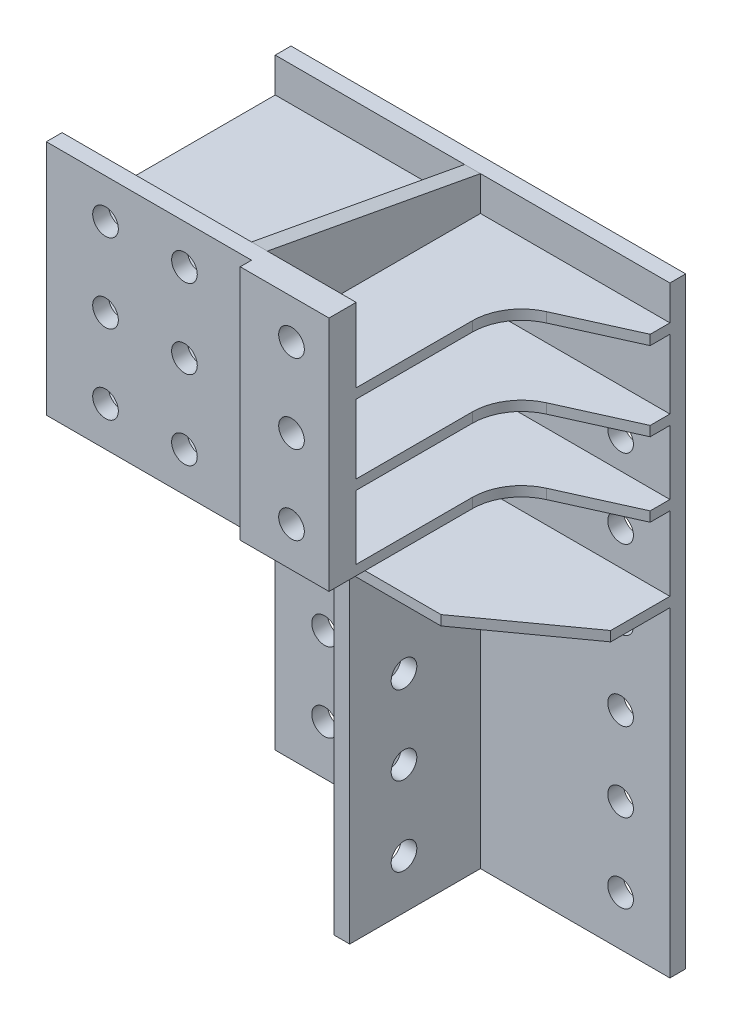
from build123d import *

# Parameters (mm, degrees)
SKETCH_1_W                       = 400
SKETCH_1_H                       = 610
EXTRUDE_1_DEPTH                  = 16
SKETCH_2_R                       = 13
CUT_EXTRUDE_1_DEPTH              = 730.627302121
PATTERN_LINEAR_1_COUNT           = 2
PATTERN_LINEAR_1_PITCH           = 300
PATTERN_LINEAR_1_COUNT_DIR2      = 6
PATTERN_LINEAR_1_PITCH_DIR2      = 80
SKETCH_3_W                       = 16
SKETCH_3_H                       = 650
EXTRUDE_2_DEPTH                  = 216
SKETCH_4_R                       = 13
CUT_EXTRUDE_2_DEPTH              = 721.824527885
SKETCH_5_W                       = 400
SKETCH_5_H                       = 10
EXTRUDE_3_DEPTH                  = 216
CUT_EXTRUDE_3_DEPTH              = 619
SKETCH_7_W                       = 400
SKETCH_7_H                       = 10
EXTRUDE_4_DEPTH                  = 132
CUT_EXTRUDE_4_DEPTH              = 10
SKETCH_9_W                       = 298
SKETCH_9_H                       = 240
EXTRUDE_5_DEPTH                  = 16
SKETCH_10_R                      = 13
CUT_EXTRUDE_5_DEPTH              = 16
PATTERN_LINEAR_2_COUNT           = 2
PATTERN_LINEAR_2_PITCH           = 80
PATTERN_LINEAR_3_COUNT           = 2
PATTERN_LINEAR_3_PITCH           = 200
PATTERN_LINEAR_4_COUNT           = 3
PATTERN_LINEAR_4_PITCH           = 80
PATTERN_LINEAR_4_COPY_1_SKETCH_R = 13
PATTERN_LINEAR_4_COPY_1_DEPTH    = 16
PATTERN_LINEAR_4_COPY_2_SKETCH_R = 13
PATTERN_LINEAR_4_COPY_2_DEPTH    = 16
PATTERN_LINEAR_4_COPY_3_SKETCH_R = 13
PATTERN_LINEAR_4_COPY_3_DEPTH    = 16
PATTERN_LINEAR_4_COPY_4_SKETCH_R = 13
PATTERN_LINEAR_4_COPY_4_DEPTH    = 16
EXTRUDE_START                    = 11.5
SKETCH_11_W                      = 90
SKETCH_11_H                      = 240
SKETCH_11_R                      = 13
EXTRUDE_6_DEPTH                  = 11.5


with BuildPart() as part:
    # 草图1 → 凸台-拉伸1 (new body)
    with BuildSketch(Plane.XY):
        with Locations((200, 305)):
            Rectangle(SKETCH_1_W, SKETCH_1_H)
    extrude(amount=EXTRUDE_1_DEPTH)

    # 草图2 → 切除-拉伸1 (cut, through all)
    with BuildSketch(Plane.XY.offset(16)):
        with Locations((50, 50)):
            Circle(SKETCH_2_R)
    cut_extrude_1 = extrude(amount=-CUT_EXTRUDE_1_DEPTH, mode=Mode.SUBTRACT)

    # 阵列(线性)1: Cut-Extrude 1 2 × 6
    with Locations(*[(i * PATTERN_LINEAR_1_PITCH, j * PATTERN_LINEAR_1_PITCH_DIR2, 0) for i in range(PATTERN_LINEAR_1_COUNT) for j in range(PATTERN_LINEAR_1_COUNT_DIR2) if (i, j) != (0, 0)]):
        add(cut_extrude_1, mode=Mode.SUBTRACT)

    # 草图3 → 凸台-拉伸2 (add)
    with BuildSketch(Plane.XY.offset(16)):
        with Locations((200, 325)):
            Rectangle(SKETCH_3_W, SKETCH_3_H)
    extrude(amount=EXTRUDE_2_DEPTH)

    # 草图4 → 切除-拉伸2 (cut, through all)
    with BuildSketch(Plane(origin=(208, 0, 0), x_dir=(0, 0, -1), z_dir=(1, 0, 0))):
        with Locations((-93.5, 210)):
            Circle(SKETCH_4_R)
        with Locations((-93.5, 130)):
            Circle(SKETCH_4_R)
        with Locations((-93.5, 50)):
            Circle(SKETCH_4_R)
        Polygon((-232, 650), (-16, 650), (-16, 610), align=None)
        with BuildLine():
            Line((-198.5, 410), (-232, 410))
            Line((-232, 410), (-232, 0))
            Line((-232, 0), (-148.5, 0))
            Line((-148.5, 0), (-148.5, 360))
            ThreePointArc((-148.5, 360), (-163.144660941, 395.355339059), (-198.5, 410))
        make_face()
    extrude(amount=-CUT_EXTRUDE_2_DEPTH, mode=Mode.SUBTRACT)

    # 草图5 → 凸台-拉伸3 (add)
    with BuildSketch(Plane.XY.offset(16)):
        with Locations((200, 570)):
            Rectangle(SKETCH_5_W, SKETCH_5_H)
        with Locations((200, 490)):
            Rectangle(SKETCH_5_W, SKETCH_5_H)
        with Locations((200, 415)):
            Rectangle(SKETCH_5_W, SKETCH_5_H)
    extrude(amount=EXTRUDE_3_DEPTH)

    # 草图6 → 切除-拉伸3 (cut, through all)
    with BuildSketch(Plane(origin=(0, 410, 0), x_dir=(-1, 0, 0), z_dir=(0, -1, 0))):
        with BuildLine():
            Line((-298, -232), (-298, -114.300395022))
            ThreePointArc((-298, -114.300395022), (-306.001372744, -87.168950007), (-327.444612345, -68.721057178))
            Line((-327.444612345, -68.721057178), (-400, -36))
            Line((-400, -36), (-400, -232))
            Line((-400, -232), (-298, -232))
        make_face()
    extrude(amount=-CUT_EXTRUDE_3_DEPTH, mode=Mode.SUBTRACT)

    # 草图7 → 凸台-拉伸4 (add)
    with BuildSketch(Plane.XY.offset(16)):
        with Locations((200, 330)):
            Rectangle(SKETCH_7_W, SKETCH_7_H)
    extrude(amount=EXTRUDE_4_DEPTH)

    # 草图8 → 切除-拉伸4 (cut)
    with BuildSketch(Plane(origin=(0, 325, 0), x_dir=(-1, 0, 0), z_dir=(0, -1, 0))):
        Polygon((-400, -148), (-300, -148), (-400, -76), align=None)
        Polygon((0, -148), (-100, -148), (0, -76), align=None)
    extrude(amount=-CUT_EXTRUDE_4_DEPTH, mode=Mode.SUBTRACT)

    # 草图9 → 凸台-拉伸5 (add)
    with BuildSketch(Plane.XY.offset(232)):
        with Locations((149, 530)):
            Rectangle(SKETCH_9_W, SKETCH_9_H)
    extrude(amount=EXTRUDE_5_DEPTH)

    # 草图10 → 切除-拉伸5 (cut)
    with BuildSketch(Plane.XY.offset(248)):
        with Locations((60, 610)):
            Circle(SKETCH_10_R)
    cut_extrude_5 = extrude(amount=-CUT_EXTRUDE_5_DEPTH, mode=Mode.SUBTRACT)

    # 阵列(线性)2: 切除-拉伸5 ×2
    with Locations(*[(i * PATTERN_LINEAR_2_PITCH, 0, 0) for i in range(1, PATTERN_LINEAR_2_COUNT)]):
        add(cut_extrude_5, mode=Mode.SUBTRACT)

    # 阵列(线性)3: 切除-拉伸5 ×2
    with Locations(*[(i * PATTERN_LINEAR_3_PITCH, 0, 0) for i in range(1, PATTERN_LINEAR_3_COUNT)]):
        add(cut_extrude_5, mode=Mode.SUBTRACT)

    # 阵列(线性)4: 切除-拉伸5 ×3
    with Locations(*[(0, -i * PATTERN_LINEAR_4_PITCH, 0) for i in range(1, PATTERN_LINEAR_4_COUNT)]):
        add(cut_extrude_5, mode=Mode.SUBTRACT)

    # 阵列(线性)4 copy 1 sketch → 阵列(线性)4 copy 1 (cut)
    with BuildSketch(Plane(origin=(80, -80, 248), x_dir=(1, 0, 0), z_dir=(0, 0, 1))):
        with Locations((60, 610)):
            Circle(PATTERN_LINEAR_4_COPY_1_SKETCH_R)
    extrude(amount=-PATTERN_LINEAR_4_COPY_1_DEPTH, mode=Mode.SUBTRACT)

    # 阵列(线性)4 copy 2 sketch → 阵列(线性)4 copy 2 (cut)
    with BuildSketch(Plane(origin=(80, -160, 248), x_dir=(1, 0, 0), z_dir=(0, 0, 1))):
        with Locations((60, 610)):
            Circle(PATTERN_LINEAR_4_COPY_2_SKETCH_R)
    extrude(amount=-PATTERN_LINEAR_4_COPY_2_DEPTH, mode=Mode.SUBTRACT)

    # 阵列(线性)4 copy 3 sketch → 阵列(线性)4 copy 3 (cut)
    with BuildSketch(Plane(origin=(200, -80, 248), x_dir=(1, 0, 0), z_dir=(0, 0, 1))):
        with Locations((60, 610)):
            Circle(PATTERN_LINEAR_4_COPY_3_SKETCH_R)
    extrude(amount=-PATTERN_LINEAR_4_COPY_3_DEPTH, mode=Mode.SUBTRACT)

    # 阵列(线性)4 copy 4 sketch → 阵列(线性)4 copy 4 (cut)
    with BuildSketch(Plane(origin=(200, -160, 248), x_dir=(1, 0, 0), z_dir=(0, 0, 1))):
        with Locations((60, 610)):
            Circle(PATTERN_LINEAR_4_COPY_4_SKETCH_R)
    extrude(amount=-PATTERN_LINEAR_4_COPY_4_DEPTH, mode=Mode.SUBTRACT)

    # 草图11 → 凸台-拉伸6 (add)
    with BuildSketch(Plane.XY.offset(248).offset(EXTRUDE_START)):
        with Locations((253, 530)):
            Rectangle(SKETCH_11_W, SKETCH_11_H)
        with Locations((260, 610)):
            Circle(SKETCH_11_R, mode=Mode.SUBTRACT)
        with Locations((260, 530)):
            Circle(SKETCH_11_R, mode=Mode.SUBTRACT)
        with Locations((260, 450)):
            Circle(SKETCH_11_R, mode=Mode.SUBTRACT)
    extrude(amount=-EXTRUDE_6_DEPTH)


solid = part.part
